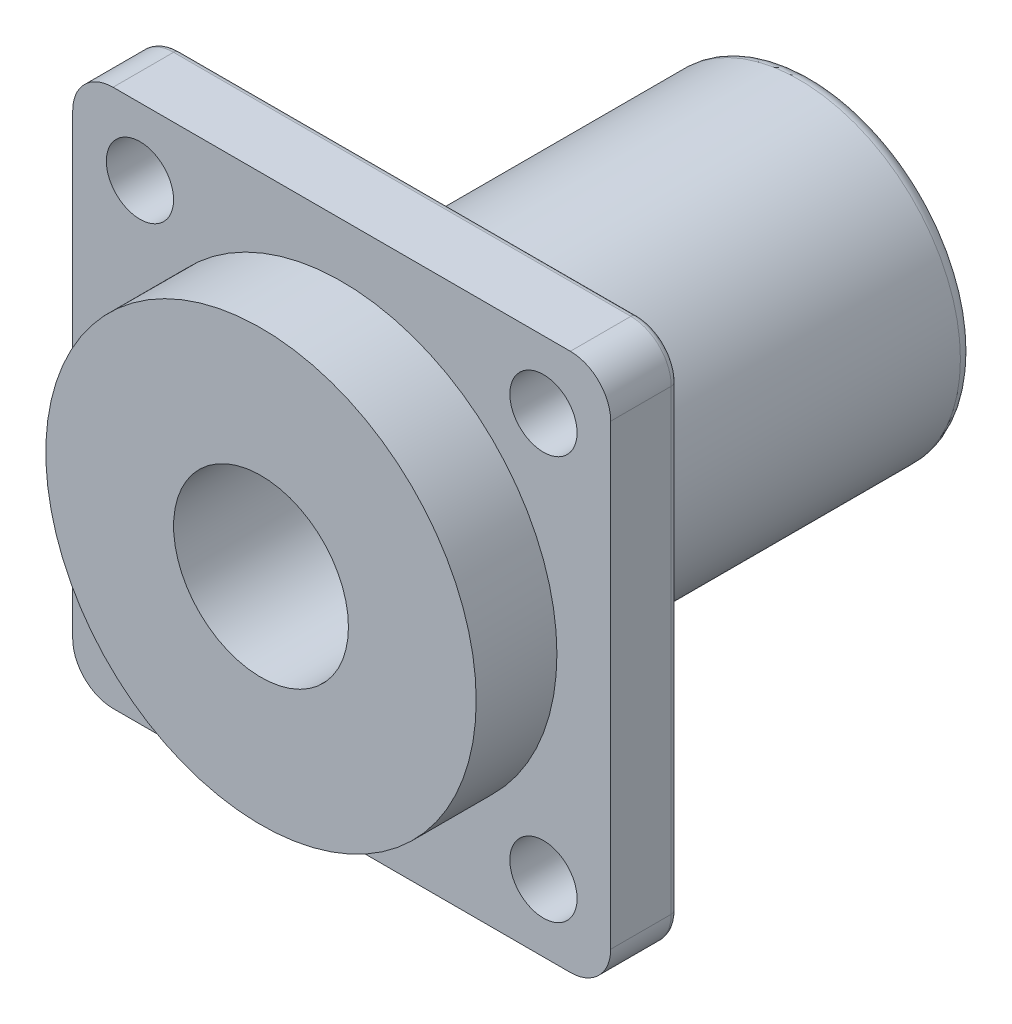
from build123d import *

# Parameters (mm, degrees)
SKETCH2_W            = 40
SKETCH2_H            = 40
SKETCH2_R            = 2.5
SKETCH2_R_2          = 16
SKETCH2_R_3          = 6.5
SKETCH2_R_4          = 12
BOSS_EXTRUDE5_DEPTH  = 2.5
BOSS_EXTRUDE8_START  = 2.5
SKETCH2_9_R          = 16
SKETCH2_9_R_2        = 6.5
SKETCH2_9_R_3        = 12
BOSS_EXTRUDE8_DEPTH  = 6
BOSS_EXTRUDE10_START = -32.5
SKETCH2_12_R         = 12
SKETCH2_12_R_2       = 6.5
BOSS_EXTRUDE10_DEPTH = 30
FILLET1_R            = 3
FILLET2_R            = 0.5
FILLET3_R            = 5
FILLET4_R            = 1


with BuildPart() as part:
    # Sketch2 → Boss-Extrude5 (new, symmetric)
    # profile 1 of 3: a face of its own
    with BuildSketch(Plane.XY):
        Rectangle(SKETCH2_W, SKETCH2_H)
        with Locations((-15, -15)):
            Circle(SKETCH2_R, mode=Mode.SUBTRACT)
        with Locations((15, -15)):
            Circle(SKETCH2_R, mode=Mode.SUBTRACT)
        with Locations((15, 15)):
            Circle(SKETCH2_R, mode=Mode.SUBTRACT)
        with Locations((-15, 15)):
            Circle(SKETCH2_R, mode=Mode.SUBTRACT)
        Circle(SKETCH2_R_2, mode=Mode.SUBTRACT)
    # profile 2 of 3: a face of its own
    with BuildSketch(Plane.XY):
        Circle(SKETCH2_R_2)
        Circle(SKETCH2_R_3, mode=Mode.SUBTRACT)
    # profile 3 of 3: a face of its own
    with BuildSketch(Plane.XY):
        Circle(SKETCH2_R_4)
        Circle(SKETCH2_R_3, mode=Mode.SUBTRACT)
    extrude(amount=BOSS_EXTRUDE5_DEPTH, both=True)

    # Sketch2<9> → Boss-Extrude8 (add)
    # profile 1 of 2: a face of its own
    with BuildSketch(Plane.XY.offset(BOSS_EXTRUDE8_START)):
        Circle(SKETCH2_9_R)
        Circle(SKETCH2_9_R_2, mode=Mode.SUBTRACT)
    # profile 2 of 2: a face of its own
    with BuildSketch(Plane.XY.offset(BOSS_EXTRUDE8_START)):
        Circle(SKETCH2_9_R_3)
        Circle(SKETCH2_9_R_2, mode=Mode.SUBTRACT)
    extrude(amount=BOSS_EXTRUDE8_DEPTH)

    # Sketch2<12> → Boss-Extrude10 (add)
    with BuildSketch(Plane.XY.offset(BOSS_EXTRUDE10_START)):
        Circle(SKETCH2_12_R)
        Circle(SKETCH2_12_R_2, mode=Mode.SUBTRACT)
    extrude(amount=BOSS_EXTRUDE10_DEPTH)

    # Fillet1
    fillet1_edges = [part.edges().sort_by_distance(p)[0] for p in [
        (20, -20, 0),
        (-20, -20, 0),
        (-20, 20, 0),
        (20, 20, 0),
    ]]
    fillet(fillet1_edges, radius=FILLET1_R)

    # Fillet2
    fillet2_edges = [part.edges().sort_by_distance(p)[0] for p in [
        (0, 20, -2.5),
        (20, 0, -2.5),
        (0, -20, -2.5),
        (-20, 0, -2.5),
        (-19.121320344, 19.121320344, -2.5),
        (-19.121320344, -19.121320344, -2.5),
        (19.121320344, -19.121320344, -2.5),
        (19.121320344, 19.121320344, -2.5),
    ]]
    fillet(fillet2_edges, radius=FILLET2_R)

    # Fillet3
    fillet3_edges = [part.edges().sort_by_distance(p)[0] for p in [
        (-12, 0, -2.5),
    ]]
    fillet(fillet3_edges, radius=FILLET3_R)

    # Fillet4
    fillet4_edges = [part.edges().sort_by_distance(p)[0] for p in [
        (-12, 0, -32.5),
    ]]
    fillet(fillet4_edges, radius=FILLET4_R)


solid = part.part
